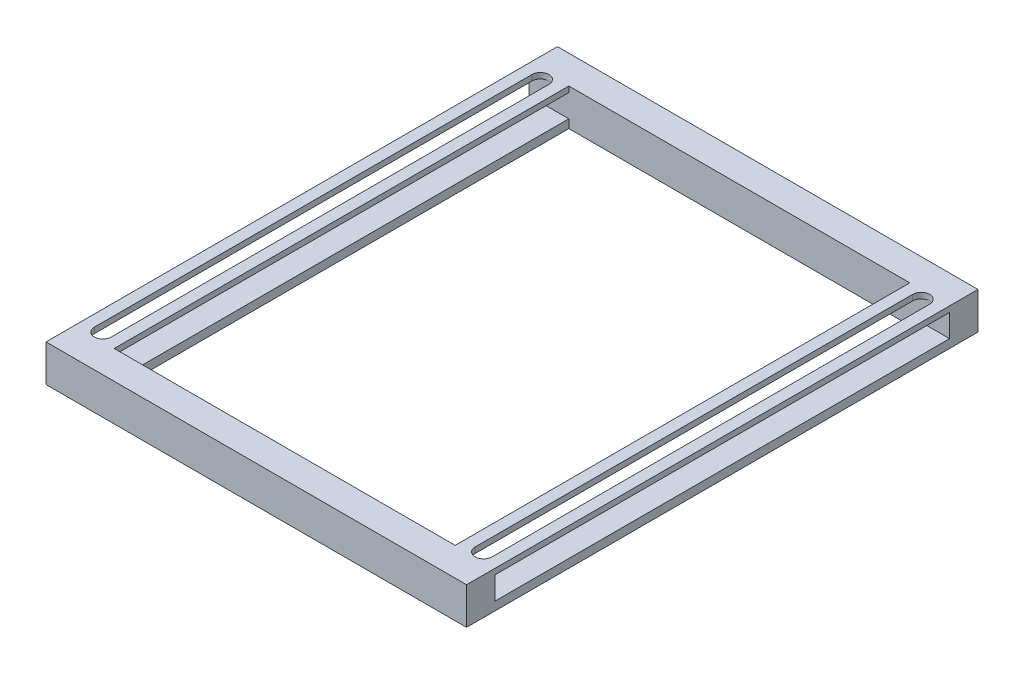
from build123d import *

# Parameters (mm, degrees)
SKETCH1_W            = 146
SKETCH1_H            = 180
BOSS_EXTRUDE1_DEPTH  = 10
BOSS_EXTRUDE9_DEPTH  = 10
BOSS_EXTRUDE10_DEPTH = 10
CUT_EXTRUDE1_DEPTH   = 8
CUT_EXTRUDE3_DEPTH   = 8
CUT_EXTRUDE5_DEPTH   = 8
SKETCH9_W            = 160
SKETCH9_H            = 5
CUT_EXTRUDE6_DEPTH   = 200
SKETCH16_W           = 2
SKETCH16_H           = 100
BOSS_EXTRUDE12_DEPTH = 2
SKETCH17_W           = 12
SKETCH17_H           = 15
CUT_EXTRUDE20_DEPTH  = 5
SKETCH18_W           = 146
SKETCH18_H           = 10
BOSS_EXTRUDE13_DEPTH = 2
SKETCH19_W           = 145
SKETCH19_H           = 3
CUT_EXTRUDE21_DEPTH  = 200
SKETCH20_W           = 146
SKETCH20_H           = 10
BOSS_EXTRUDE14_DEPTH = 1
CUT_EXTRUDE14_DEPTH  = 200
SKETCH26_W           = 15
SKETCH26_H           = 3
BOSS_EXTRUDE24_DEPTH = 12
SKETCH27_W           = 15
SKETCH27_H           = 3
BOSS_EXTRUDE25_DEPTH = 12
SKETCH28_W           = 7.806424589
SKETCH28_H           = 4.847825316
SKETCH28_W_2         = 8.08212844
SKETCH28_H_2         = 5.143440523
BOSS_EXTRUDE27_DEPTH = 146
SKETCH29_W           = 10.987975608
SKETCH29_H           = 7.251742555
SKETCH29_H_2         = 6.917732736
BOSS_EXTRUDE28_DEPTH = 13
SKETCH30_W           = 160
SKETCH30_H           = 3
SKETCH30_H_2         = 2
BOSS_EXTRUDE29_DEPTH = 1
SKETCH31_W           = 160
SKETCH31_H           = 2
SKETCH31_H_2         = 3
BOSS_EXTRUDE30_DEPTH = 1
SKETCH32_W           = 160
SKETCH32_H           = 3
SKETCH32_H_2         = 2
BOSS_EXTRUDE31_DEPTH = 1
SKETCH33_W           = 160
SKETCH33_H           = 3
SKETCH33_H_2         = 2
BOSS_EXTRUDE32_DEPTH = 1
SKETCH34_W           = 5
SKETCH34_H           = 110
BOSS_EXTRUDE33_DEPTH = 2.5
SKETCH22_W           = 5
SKETCH22_H           = 100
BOSS_EXTRUDE16_DEPTH = 2
CUT_EXTRUDE16_DEPTH  = 2
CUT_EXTRUDE17_DEPTH  = 2
SKETCH24_W           = 6.837176559
SKETCH24_H           = 5.891562969
BOSS_EXTRUDE19_DEPTH = 8
SKETCH25_W           = 15
SKETCH25_H           = 3
BOSS_EXTRUDE21_DEPTH = 12
CUT_EXTRUDE18_DEPTH  = 2
SKETCH14_W           = 166
SKETCH14_H           = 200
BOSS_EXTRUDE11_DEPTH = 1
SKETCH15_W           = 166
SKETCH15_H           = 200
SKETCH15_W_2         = 148
SKETCH15_H_2         = 180
SKETCH15_W_3         = 120
SKETCH15_H_3         = 160
CUT_EXTRUDE19_DEPTH  = 10000


with BuildPart() as part:
    # Sketch1 → Boss-Extrude1 (new body)
    with BuildSketch(Plane(origin=(0, 0, 0), x_dir=(1, 0, 0), z_dir=(0, 1, 0))):
        with Locations((85.404053839, 96.548093588)):
            Rectangle(SKETCH1_W, SKETCH1_H)
        with BuildLine():
            Line((24.404053839, 16.548093588), (24.404053839, 176.548093588))
            Line((24.404053839, 176.548093588), (82.654053839, 176.548093588))
            ThreePointArc((82.654053839, 176.548093588), (82.830830534, 176.621316892), (82.904053839, 176.798093588))
            Line((82.904053839, 176.798093588), (82.904053839, 181.298093588))
            ThreePointArc((82.904053839, 181.298093588), (82.977277144, 181.474870283), (83.154053839, 181.548093588))
            Line((83.154053839, 181.548093588), (87.654053839, 181.548093588))
            ThreePointArc((87.654053839, 181.548093588), (87.830830534, 181.474870283), (87.904053839, 181.298093588))
            Line((87.904053839, 181.298093588), (87.904053839, 176.798093588))
            ThreePointArc((87.904053839, 176.798093588), (87.977277144, 176.621316892), (88.154053839, 176.548093588))
            Line((88.154053839, 176.548093588), (146.404053839, 176.548093588))
            Line((146.404053839, 176.548093588), (146.404053839, 16.548093588))
            Line((146.404053839, 16.548093588), (88.154053839, 16.548093588))
            ThreePointArc((88.154053839, 16.548093588), (87.977277144, 16.474870283), (87.904053839, 16.298093588))
            Line((87.904053839, 16.298093588), (87.904053839, 11.798093588))
            ThreePointArc((87.904053839, 11.798093588), (87.830830534, 11.621316892), (87.654053839, 11.548093588))
            Line((87.654053839, 11.548093588), (83.154053839, 11.548093588))
            ThreePointArc((83.154053839, 11.548093588), (82.977277144, 11.621316892), (82.904053839, 11.798093588))
            Line((82.904053839, 11.798093588), (82.904053839, 16.298093588))
            ThreePointArc((82.904053839, 16.298093588), (82.830830534, 16.474870283), (82.654053839, 16.548093588))
            Line((82.654053839, 16.548093588), (24.404053839, 16.548093588))
        make_face(mode=Mode.SUBTRACT)
    extrude(amount=BOSS_EXTRUDE1_DEPTH)

    # Sketch2 → Boss-Extrude9 (add)
    with BuildSketch(Plane(origin=(0, 0, 0), x_dir=(-1, 0, 0), z_dir=(0, -1, 0))):
        with BuildLine():
            Line((-82.654053839, 16.548093588), (-88.154053839, 16.548093588))
            ThreePointArc((-88.154053839, 16.548093588), (-87.977277144, 16.474870283), (-87.904053839, 16.298093588))
            Line((-87.904053839, 16.298093588), (-87.904053839, 11.798093588))
            ThreePointArc((-87.904053839, 11.798093588), (-87.830830534, 11.621316892), (-87.654053839, 11.548093588))
            Line((-87.654053839, 11.548093588), (-83.154053839, 11.548093588))
            ThreePointArc((-83.154053839, 11.548093588), (-82.977277144, 11.621316892), (-82.904053839, 11.798093588))
            Line((-82.904053839, 11.798093588), (-82.904053839, 16.298093588))
            ThreePointArc((-82.904053839, 16.298093588), (-82.830830534, 16.474870283), (-82.654053839, 16.548093588))
        make_face()
    extrude(amount=-BOSS_EXTRUDE9_DEPTH)

    # Sketch5 → Boss-Extrude10 (add)
    with BuildSketch(Plane(origin=(0, 0, 0), x_dir=(-1, 0, 0), z_dir=(0, -1, 0))):
        with BuildLine():
            Line((-82.654053839, 176.548093588), (-88.154053839, 176.548093588))
            ThreePointArc((-88.154053839, 176.548093588), (-87.977277144, 176.621316892), (-87.904053839, 176.798093588))
            Line((-87.904053839, 176.798093588), (-87.904053839, 181.298093588))
            ThreePointArc((-87.904053839, 181.298093588), (-87.830830534, 181.474870283), (-87.654053839, 181.548093588))
            Line((-87.654053839, 181.548093588), (-83.154053839, 181.548093588))
            ThreePointArc((-83.154053839, 181.548093588), (-82.977277144, 181.474870283), (-82.904053839, 181.298093588))
            Line((-82.904053839, 181.298093588), (-82.904053839, 176.798093588))
            ThreePointArc((-82.904053839, 176.798093588), (-82.830830534, 176.621316892), (-82.654053839, 176.548093588))
        make_face()
    extrude(amount=-BOSS_EXTRUDE10_DEPTH)

    # Sketch6 → Cut-Extrude1 (cut)
    with BuildSketch(Plane(origin=(0, 10, 0), x_dir=(1, 0, 0), z_dir=(0, 1, 0))):
        with BuildLine():
            Line((83.154053839, 181.548093588), (87.654053839, 181.548093588))
            ThreePointArc((87.654053839, 181.548093588), (87.830830534, 181.474870283), (87.904053839, 181.298093588))
            Line((87.904053839, 181.298093588), (87.904053839, 176.798093588))
            ThreePointArc((87.904053839, 176.798093588), (87.977277144, 176.621316892), (88.154053839, 176.548093588))
            Line((88.154053839, 176.548093588), (82.654053839, 176.548093588))
            ThreePointArc((82.654053839, 176.548093588), (82.830830534, 176.621316892), (82.904053839, 176.798093588))
            Line((82.904053839, 176.798093588), (82.904053839, 181.298093588))
            ThreePointArc((82.904053839, 181.298093588), (82.977277144, 181.474870283), (83.154053839, 181.548093588))
        make_face()
    extrude(amount=-CUT_EXTRUDE1_DEPTH, mode=Mode.SUBTRACT)

    # Sketch7 → Cut-Extrude3 (cut)
    with BuildSketch(Plane(origin=(0, 10, 0), x_dir=(1, 0, 0), z_dir=(0, 1, 0))):
        with BuildLine():
            Line((87.904053839, 11.798093588), (87.904053839, 16.298093588))
            ThreePointArc((87.904053839, 16.298093588), (87.977277144, 16.474870283), (88.154053839, 16.548093588))
            Line((88.154053839, 16.548093588), (82.654053839, 16.548093588))
            ThreePointArc((82.654053839, 16.548093588), (82.830830534, 16.474870283), (82.904053839, 16.298093588))
            Line((82.904053839, 16.298093588), (82.904053839, 11.798093588))
            ThreePointArc((82.904053839, 11.798093588), (82.977277144, 11.621316892), (83.154053839, 11.548093588))
            Line((83.154053839, 11.548093588), (87.654053839, 11.548093588))
            ThreePointArc((87.654053839, 11.548093588), (87.830830534, 11.621316892), (87.904053839, 11.798093588))
        make_face()
    extrude(amount=-CUT_EXTRUDE3_DEPTH, mode=Mode.SUBTRACT)

    # Sketch8 → Cut-Extrude5 (cut)
    with BuildSketch(Plane(origin=(0, 10, 0), x_dir=(1, 0, 0), z_dir=(0, 1, 0))):
        with BuildLine():
            Line((21.404053839, 173.548093588), (21.404053839, 19.548093588))
            ThreePointArc((21.404053839, 19.548093588), (18.404053839, 16.548093588), (15.404053839, 19.548093588))
            Line((15.404053839, 19.548093588), (15.404053839, 173.548093588))
            ThreePointArc((15.404053839, 173.548093588), (18.404053839, 176.548093588), (21.404053839, 173.548093588))
        make_face()
        with BuildLine():
            Line((155.404053839, 173.548093588), (155.404053839, 19.548093588))
            ThreePointArc((155.404053839, 19.548093588), (152.404053839, 16.548093588), (149.404053839, 19.548093588))
            Line((149.404053839, 19.548093588), (149.404053839, 173.548093588))
            ThreePointArc((149.404053839, 173.548093588), (152.404053839, 176.548093588), (155.404053839, 173.548093588))
        make_face()
    extrude(amount=-CUT_EXTRUDE5_DEPTH, mode=Mode.SUBTRACT)

    # Sketch9 → Cut-Extrude6 (cut)
    with BuildSketch(Plane(origin=(158.404053839, 0, 0), x_dir=(0, 0, -1), z_dir=(1, 0, 0))):
        with Locations((96.548093588, 5.5)):
            Rectangle(SKETCH9_W, SKETCH9_H)
    extrude(amount=-CUT_EXTRUDE6_DEPTH, mode=Mode.SUBTRACT)

    # Sketch16 → Boss-Extrude12 (add)
    with BuildSketch(Plane(origin=(0, 0, 0), x_dir=(-1, 0, 0), z_dir=(0, -1, 0))):
        Polygon((-151.404053839, 46.548093587), (-153.404053839, 46.548093588), (-153.404053839, 146.548093588), (-151.404053839, 146.548093588), align=None)
        with Locations((-18.404053839, 96.548093588)):
            Rectangle(SKETCH16_W, SKETCH16_H)
    extrude(amount=BOSS_EXTRUDE12_DEPTH)

    # Sketch17 → Cut-Extrude20 (cut)
    with BuildSketch(Plane(origin=(0, 0, 0), x_dir=(-1, 0, 0), z_dir=(0, -1, 0))):
        with Locations((-152.404053839, 24.048093588)):
            Rectangle(SKETCH17_W, SKETCH17_H)
        with Locations((-18.404053839, 24.048093588)):
            Rectangle(SKETCH17_W, SKETCH17_H)
    extrude(amount=-CUT_EXTRUDE20_DEPTH, mode=Mode.SUBTRACT)

    # Sketch18 → Boss-Extrude13 (add)
    with BuildSketch(Plane(origin=(0, 0, 0), x_dir=(-1, 0, 0), z_dir=(0, -1, 0))):
        with Locations((-85.404053839, 11.548093588)):
            Rectangle(SKETCH18_W, SKETCH18_H)
        Polygon((-158.404053839, 31.548093588), (-146.404053839, 31.548093588), (-146.404053839, 176.548093588), (-24.404053839, 176.548093588), (-24.404053839, 31.548093588), (-12.404053839, 31.548093588), (-12.404053839, 186.548093588), (-158.404053839, 186.548093588), align=None)
    extrude(amount=BOSS_EXTRUDE13_DEPTH)

    # Sketch19 → Cut-Extrude21 (cut)
    with BuildSketch(Plane.ZY.offset(-12.404053839)):
        with Locations((-104.048093588, 1.5)):
            Rectangle(SKETCH19_W, SKETCH19_H)
    extrude(amount=-CUT_EXTRUDE21_DEPTH, mode=Mode.SUBTRACT)

    # Sketch20 → Boss-Extrude14 (add)
    with BuildSketch(Plane(origin=(0, -2, 0), x_dir=(-1, 0, 0), z_dir=(0, -1, 0))):
        with Locations((-85.404053839, 11.548093588)):
            Rectangle(SKETCH20_W, SKETCH20_H)
        Polygon((-158.404053839, 31.548093588), (-146.404053839, 31.548093588), (-146.404053839, 176.548093588), (-24.404053839, 176.548093588), (-24.404053839, 31.548093588), (-12.404053839, 31.548093588), (-12.404053839, 186.548093588), (-158.404053839, 186.548093588), align=None)
    extrude(amount=BOSS_EXTRUDE14_DEPTH)

    # Sketch10 → Cut-Extrude14 (cut)
    with BuildSketch(Plane.ZY.offset(-12.404053839)):
        with BuildLine():
            Line((-14.670592587, 0), (-8.425594588, 0))
            ThreePointArc((-8.425594588, 0), (-11.548093588, 1.5), (-14.670592587, 0))
        make_face()
        with BuildLine():
            Line((-184.670592587, 0), (-178.425594588, 0))
            ThreePointArc((-178.425594588, 0), (-181.548093588, 1.5), (-184.670592587, 0))
        make_face()
    extrude(amount=-CUT_EXTRUDE14_DEPTH, mode=Mode.SUBTRACT)

    # Sketch26 → Boss-Extrude24 (add)
    with BuildSketch(Plane.ZY.offset(-146.404053839)):
        with Locations((-24.048093588, -1.5)):
            Rectangle(SKETCH26_W, SKETCH26_H)
    extrude(amount=-BOSS_EXTRUDE24_DEPTH)

    # Sketch27 → Boss-Extrude25 (add)
    with BuildSketch(Plane(origin=(24.404053839, 0, 0), x_dir=(0, 0, -1), z_dir=(1, 0, 0))):
        with Locations((24.048093588, -1.5)):
            Rectangle(SKETCH27_W, SKETCH27_H)
    extrude(amount=-BOSS_EXTRUDE25_DEPTH)

    # Sketch28 → Boss-Extrude27 (add)
    with BuildSketch(Plane(origin=(158.404053839, 0, 0), x_dir=(0, 0, -1), z_dir=(1, 0, 0))):
        with Locations((11.32588383, 1.141613022)):
            Rectangle(SKETCH28_W, SKETCH28_H)
        with Locations((181.472700273, 0.993805419)):
            Rectangle(SKETCH28_W_2, SKETCH28_H_2)
    extrude(amount=-BOSS_EXTRUDE27_DEPTH)

    # Sketch29 → Boss-Extrude28 (add)
    with BuildSketch(Plane(origin=(0, -3, 0), x_dir=(-1, 0, 0), z_dir=(0, -1, 0))):
        with Locations((-86.043966063, 180.173964866)):
            Rectangle(SKETCH29_W, SKETCH29_H)
        with Locations((-86.043966063, 13.08922722)):
            Rectangle(SKETCH29_W, SKETCH29_H_2)
    extrude(amount=-BOSS_EXTRUDE28_DEPTH)

    # Sketch30 → Boss-Extrude29 (add)
    with BuildSketch(Plane.ZY.offset(-12.404053839)):
        Polygon((-176.548093588, 10), (-186.548093588, 10), (-186.548093588, -3), (-176.548093588, -3), (-176.548093588, 0), (-176.548093588, 8), align=None)
        with Locations((-96.548093588, -1.5)):
            Rectangle(SKETCH30_W, SKETCH30_H)
        with Locations((-96.548093588, 9)):
            Rectangle(SKETCH30_W, SKETCH30_H_2)
        Polygon((-6.548093588, 10), (-16.548093588, 10), (-16.548093588, 8), (-16.548093588, 0), (-16.548093588, -3), (-6.548093588, -3), align=None)
    extrude(amount=BOSS_EXTRUDE29_DEPTH)

    # Sketch31 → Boss-Extrude30 (add)
    with BuildSketch(Plane(origin=(158.404053839, 0, 0), x_dir=(0, 0, -1), z_dir=(1, 0, 0))):
        Polygon((176.548093588, -3), (186.548093588, -3), (186.548093588, 10), (176.548093588, 10), (176.548093588, 8), (176.548093588, 0), align=None)
        with Locations((96.548093588, 9)):
            Rectangle(SKETCH31_W, SKETCH31_H)
        with Locations((96.548093588, -1.5)):
            Rectangle(SKETCH31_W, SKETCH31_H_2)
        Polygon((6.548093588, -3), (16.548093588, -3), (16.548093588, 0), (16.548093588, 8), (16.548093588, 10), (6.548093588, 10), align=None)
    extrude(amount=BOSS_EXTRUDE30_DEPTH)

    # Sketch32 → Boss-Extrude31 (add)
    with BuildSketch(Plane.ZY.offset(-146.404053839)):
        with Locations((-96.548093588, -1.5)):
            Rectangle(SKETCH32_W, SKETCH32_H)
        with Locations((-96.548093588, 9)):
            Rectangle(SKETCH32_W, SKETCH32_H_2)
    extrude(amount=BOSS_EXTRUDE31_DEPTH)

    # Sketch33 → Boss-Extrude32 (add)
    with BuildSketch(Plane(origin=(24.404053839, 0, 0), x_dir=(0, 0, -1), z_dir=(1, 0, 0))):
        with Locations((96.548093588, -1.5)):
            Rectangle(SKETCH33_W, SKETCH33_H)
        with Locations((96.548093588, 9)):
            Rectangle(SKETCH33_W, SKETCH33_H_2)
    extrude(amount=BOSS_EXTRUDE32_DEPTH)

    # Sketch34 → Boss-Extrude33 (add)
    with BuildSketch(Plane(origin=(0, -3, 0), x_dir=(-1, 0, 0), z_dir=(0, -1, 0))):
        with Locations((-152.404053839, 96.548093588)):
            Rectangle(SKETCH34_W, SKETCH34_H)
        with Locations((-18.404053839, 96.548093588)):
            Rectangle(SKETCH34_W, SKETCH34_H)
    extrude(amount=BOSS_EXTRUDE33_DEPTH)

    # Sketch22 → Boss-Extrude16 (add)
    with BuildSketch(Plane(origin=(0, -3, 0), x_dir=(-1, 0, 0), z_dir=(0, -1, 0))):
        with Locations((-152.404053839, 96.548093588)):
            Rectangle(SKETCH22_W, SKETCH22_H)
        with Locations((-18.404053839, 96.548093588)):
            Rectangle(SKETCH22_W, SKETCH22_H)
    extrude(amount=BOSS_EXTRUDE16_DEPTH)

    # Sketch11 → Cut-Extrude16 (cut)
    with BuildSketch(Plane(origin=(158.404053839, 0, 0), x_dir=(0, 0, -1), z_dir=(1, 0, 0))):
        Polygon((21.548093588, 0), (21.548093588, 1.5), (27.146169799, 0), align=None)
    extrude(amount=-CUT_EXTRUDE16_DEPTH, mode=Mode.SUBTRACT)

    # Sketch12 → Cut-Extrude17 (cut)
    with BuildSketch(Plane(origin=(158.404053839, 0, 0), x_dir=(0, 0, -1), z_dir=(1, 0, 0))):
        Polygon((165.948093588, 0), (165.948093588, 1.5), (171.546169799, 0), align=None)
    extrude(amount=-CUT_EXTRUDE17_DEPTH, mode=Mode.SUBTRACT)

    # Sketch24 → Boss-Extrude19 (add)
    with BuildSketch(Plane(origin=(0, 2, 0), x_dir=(1, 0, 0), z_dir=(0, 1, 0))):
        with Locations((85.342908549, 13.602312104)):
            Rectangle(SKETCH24_W, SKETCH24_H)
        Polygon((88.761496828, 176.548093588), (88.761496828, 183.338705529), (80.923906639, 182.847568728), (80.923906639, 176.548093588), align=None)
    extrude(amount=BOSS_EXTRUDE19_DEPTH)

    # Sketch25 → Boss-Extrude21 (add)
    with BuildSketch(Plane(origin=(24.404053839, 0, 0), x_dir=(0, 0, -1), z_dir=(1, 0, 0))):
        with Locations((24.048093588, -1.5)):
            Rectangle(SKETCH25_W, SKETCH25_H)
    extrude(amount=-BOSS_EXTRUDE21_DEPTH)

    # Sketch13 → Cut-Extrude18 (cut)
    with BuildSketch(Plane.ZY.offset(-12.404053839)):
        Polygon((-171.546169799, 0), (-171.546169799, 1.5), (-165.948093588, 0), align=None)
        Polygon((-27.146169799, 0), (-27.146169799, 1.5), (-21.548093587, 0), align=None)
    extrude(amount=-CUT_EXTRUDE18_DEPTH, mode=Mode.SUBTRACT)

    # Sketch14 → Boss-Extrude11 (add)
    with BuildSketch(Plane(origin=(0, 0, 0), x_dir=(-1, 0, 0), z_dir=(0, -1, 0))):
        with Locations((-85.404053839, 96.548093588)):
            Rectangle(SKETCH14_W, SKETCH14_H)
    extrude(amount=BOSS_EXTRUDE11_DEPTH)

    # Sketch15 → Cut-Extrude19 (cut)
    # profile 1 of 2: a face of its own
    with BuildSketch(Plane.XZ.offset(1)):
        with Locations((85.404053839, -96.548093588)):
            Rectangle(SKETCH15_W, SKETCH15_H)
        with Locations((85.404053839, -96.548093588)):
            Rectangle(SKETCH15_W_2, SKETCH15_H_2, mode=Mode.SUBTRACT)
    # profile 2 of 2: a face of its own
    with BuildSketch(Plane.XZ.offset(1)):
        with Locations((85.404053839, -96.548093588)):
            Rectangle(SKETCH15_W_3, SKETCH15_H_3)
    extrude(amount=-CUT_EXTRUDE19_DEPTH, mode=Mode.SUBTRACT)


solid = part.part
